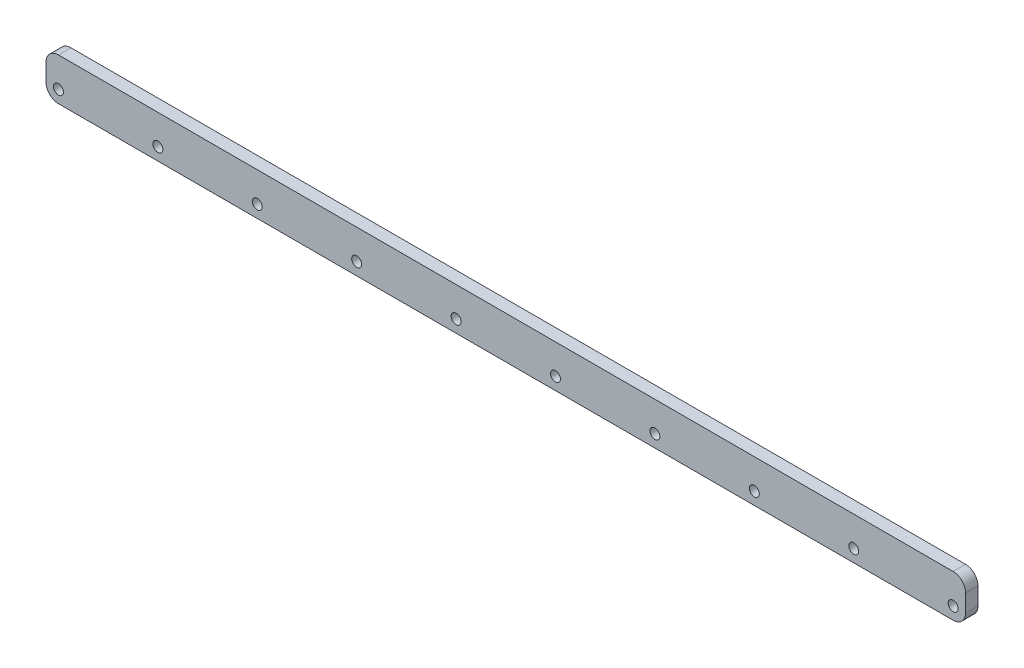
from build123d import *

# Parameters (mm, degrees)
ESQUISSE1_W        = 370
ESQUISSE1_H        = 17
ESQUISSE1_R        = 2
BOSS_EXTRU_1_DEPTH = 5
CONG_1_R           = 5


with BuildPart() as part:
    # Esquisse1 → Boss.-Extru.1 (new body)
    with BuildSketch(Plane.XY):
        with Locations((185, 8.5)):
            Rectangle(ESQUISSE1_W, ESQUISSE1_H)
        with Locations((5, 5)):
            Circle(ESQUISSE1_R, mode=Mode.SUBTRACT)
        with Locations((45, 5)):
            Circle(ESQUISSE1_R, mode=Mode.SUBTRACT)
        with Locations((85, 5)):
            Circle(ESQUISSE1_R, mode=Mode.SUBTRACT)
        with Locations((125, 5)):
            Circle(ESQUISSE1_R, mode=Mode.SUBTRACT)
        with Locations((165, 5)):
            Circle(ESQUISSE1_R, mode=Mode.SUBTRACT)
        with Locations((205, 5)):
            Circle(ESQUISSE1_R, mode=Mode.SUBTRACT)
        with Locations((245, 5)):
            Circle(ESQUISSE1_R, mode=Mode.SUBTRACT)
        with Locations((285, 5)):
            Circle(ESQUISSE1_R, mode=Mode.SUBTRACT)
        with Locations((325, 5)):
            Circle(ESQUISSE1_R, mode=Mode.SUBTRACT)
        with Locations((365, 5)):
            Circle(ESQUISSE1_R, mode=Mode.SUBTRACT)
    extrude(amount=BOSS_EXTRU_1_DEPTH)

    # Congé1
    cong_1_edges = [part.edges().sort_by_distance(p)[0] for p in [
        (0, 17, 2.5),
        (370, 17, 2.5),
        (370, 0, 2.5),
        (0, 0, 2.5),
    ]]
    fillet(cong_1_edges, radius=CONG_1_R)


solid = part.part
